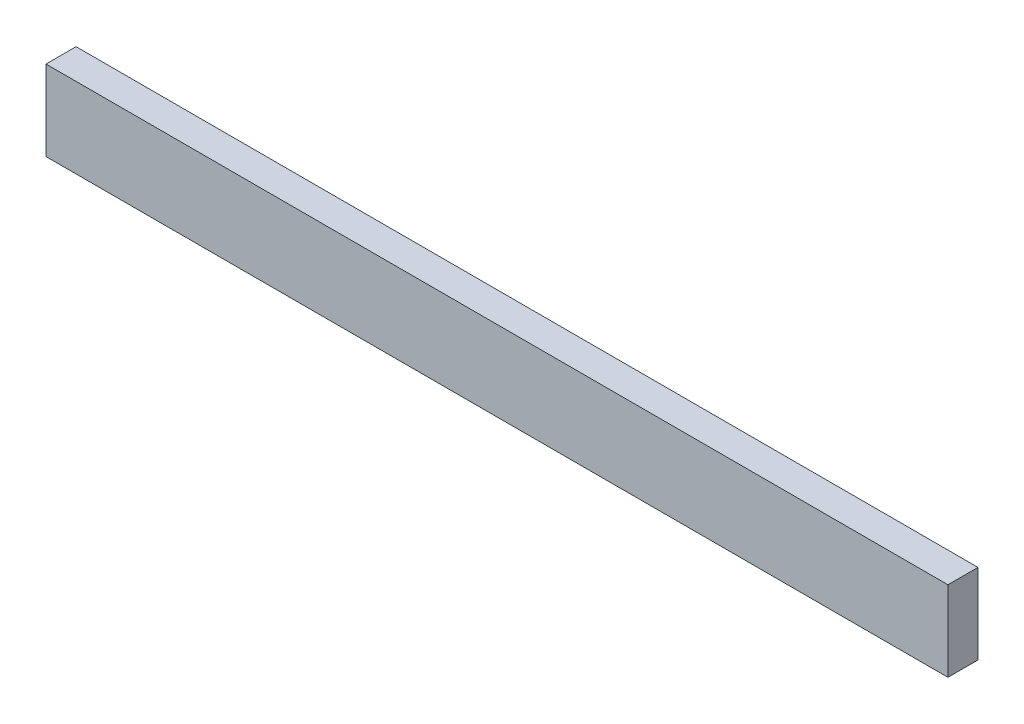
from build123d import *

# Parameters (mm, degrees)
ESBO_O1_W                = 90
ESBO_O1_H                = 8
RESSALTO_EXTRUS_O1_DEPTH = 3


with BuildPart() as part:
    # Esboço1 → Ressalto-extrusão1 (new body)
    with BuildSketch(Plane.XY):
        Rectangle(ESBO_O1_W, ESBO_O1_H)
    extrude(amount=RESSALTO_EXTRUS_O1_DEPTH)


solid = part.part
